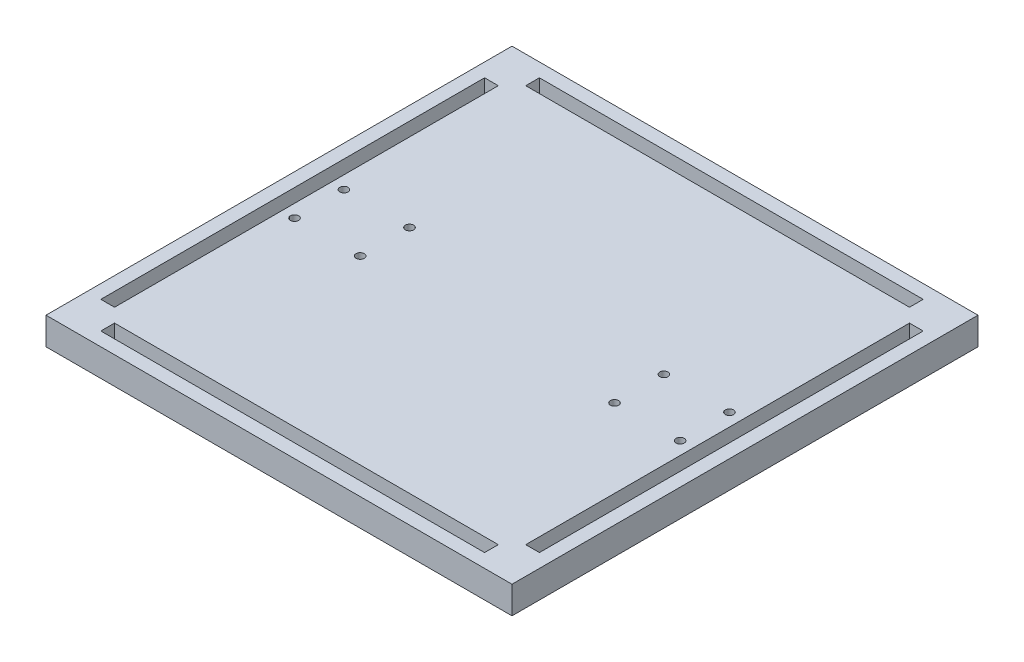
from build123d import *

# Parameters (mm, degrees)
SKETCH2_W               = 170
SKETCH2_H               = 170
BOSS_EXTRUDE1_DEPTH     = 10
SKETCH3_W               = 5
SKETCH3_H               = 140
SKETCH3_W_2             = 140
SKETCH3_H_2             = 4.998101886
SKETCH3_H_3             = 5
CUT_EXTRUDE1_DEPTH      = 10
CUT_EXTRUDE2_DEPTH      = 121.623380818
CUT_EXTRUDE2_DEPTH_BACK = 121.623380818
SKETCH4_R               = 1.5


with BuildPart() as part:
    # Sketch2 → Boss-Extrude1 (new body)
    with BuildSketch(Plane(origin=(0, 0, 0), x_dir=(1, 0, 0), z_dir=(0, 1, 0))):
        Rectangle(SKETCH2_W, SKETCH2_H)
    extrude(amount=BOSS_EXTRUDE1_DEPTH)

    # Sketch3 → Cut-Extrude1 (cut)
    with BuildSketch(Plane(origin=(0, 10, 0), x_dir=(1, 0, 0), z_dir=(0, 1, 0))):
        with Locations((-77.5, 0)):
            Rectangle(SKETCH3_W, SKETCH3_H)
        with Locations((0, -77.500949057)):
            Rectangle(SKETCH3_W_2, SKETCH3_H_2)
        with Locations((77.5, 0)):
            Rectangle(SKETCH3_W, SKETCH3_H)
        with Locations((0, 77.5)):
            Rectangle(SKETCH3_W_2, SKETCH3_H_3)
    extrude(amount=-CUT_EXTRUDE1_DEPTH, mode=Mode.SUBTRACT)

    # Sketch4 → Cut-Extrude2 (cut, two sides: drawn at the far end of the back side and taken through both)
    with BuildSketch(Plane(origin=(0, 0, 0), x_dir=(-1, 0, 0), z_dir=(0, -1, 0)).offset(-CUT_EXTRUDE2_DEPTH_BACK)):
        with Locations(Location((-70.33, -9, 0), (0, 0, 270))):
            Circle(SKETCH4_R)
        with Locations(Location((-70.33, 9, 0), (0, 0, 270))):
            Circle(SKETCH4_R)
        with Locations(Location((70.33, 9, 0), (0, 0, 270))):
            Circle(SKETCH4_R)
        with Locations(Location((70.33, -9, 0), (0, 0, 270))):
            Circle(SKETCH4_R)
        with Locations(Location((46.4, 9, 0), (0, 0, 270))):
            Circle(SKETCH4_R)
        with Locations(Location((46.4, -9, 0), (0, 0, 270))):
            Circle(SKETCH4_R)
        with Locations(Location((-46.4, -9, 0), (0, 0, 270))):
            Circle(SKETCH4_R)
        with Locations(Location((-46.4, 9, 0), (0, 0, 270))):
            Circle(SKETCH4_R)
    extrude(amount=CUT_EXTRUDE2_DEPTH + CUT_EXTRUDE2_DEPTH_BACK, mode=Mode.SUBTRACT)


solid = part.part
